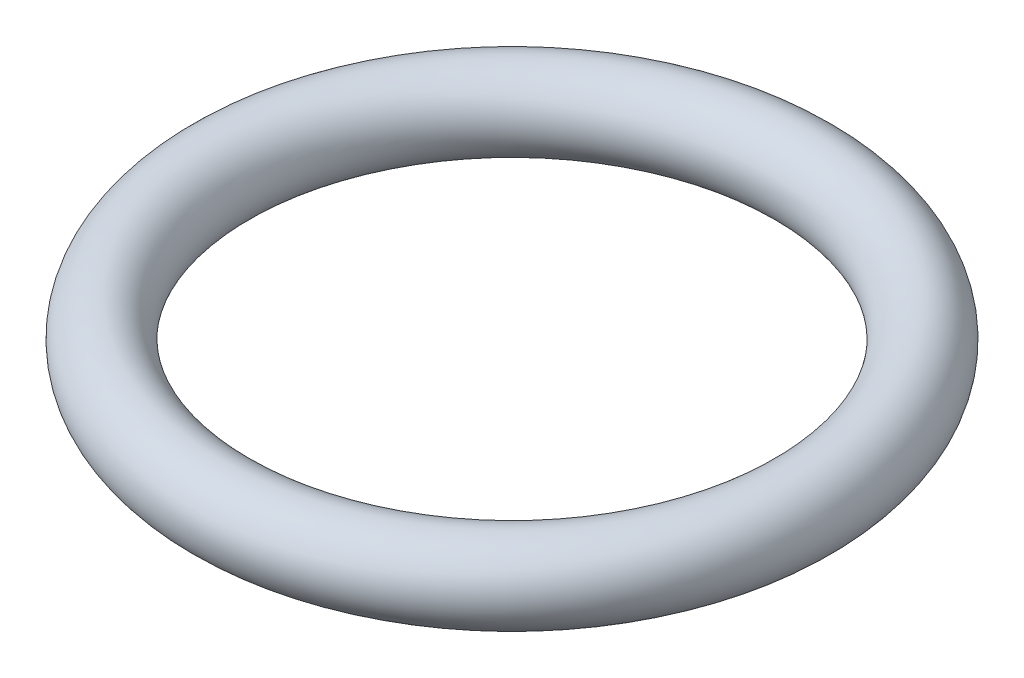
from build123d import *

# Parameters (mm, degrees)
SKETCH1_R = 3.96875


with BuildPart() as part:
    # Sketch1 → Revolve1 (revolve)
    with BuildSketch(Plane.XY, mode=Mode.PRIVATE) as revolve1_sk:
        with Locations((29.36875, 0)):
            Circle(SKETCH1_R)
    revolve(revolve1_sk.sketch.rotate(Axis((0, 0, 0), (0, 1, 0)), 90), axis=Axis((0, 0, 0), (0, 1, 0)))


solid = part.part
